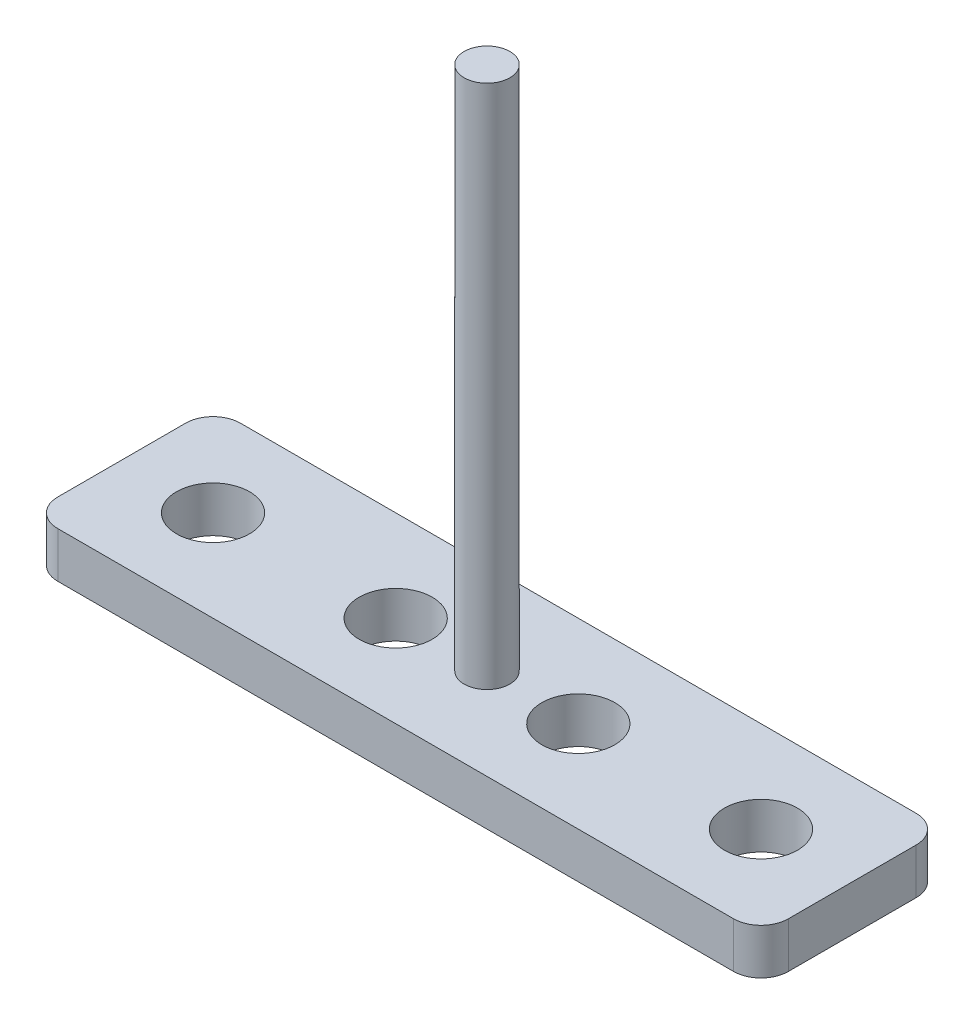
from build123d import *

# Parameters (mm, degrees)
SKETCH1_W             = 80
SKETCH1_H             = 20
BOSS_EXTRUDE1_DEPTH   = 2.5
F_8_0MM_DOWEL_HOLE1_D = 8
SKETCH6_R             = 2.5
BOSS_EXTRUDE2_DEPTH   = 60
FILLET1_R             = 3


with BuildPart() as part:
    # Sketch1 → Boss-Extrude1 (new, symmetric)
    with BuildSketch(Plane(origin=(0, 0, 0), x_dir=(1, 0, 0), z_dir=(0, 1, 0))):
        Rectangle(SKETCH1_W, SKETCH1_H)
    extrude(amount=BOSS_EXTRUDE1_DEPTH, both=True)

    # Ø8.0mm Dowel Hole1 (through all)
    with Locations(Plane(origin=(0, 2.5, 0), x_dir=(1, 0, 0), z_dir=(0, 1, 0))):
        with Locations((-30, 0), (-10, 0), (10, 0), (30, 0)):
            Hole(F_8_0MM_DOWEL_HOLE1_D / 2)

    # Sketch6 → Boss-Extrude2 (add)
    with BuildSketch(Plane(origin=(0, 0, 0), x_dir=(1, 0, 0), z_dir=(0, 1, 0))):
        with Locations(Location((0, 0, 0), (0, 0, 90))):
            Circle(SKETCH6_R)
    extrude(amount=BOSS_EXTRUDE2_DEPTH)

    # Fillet1
    fillet1_edges = [part.edges().sort_by_distance(p)[0] for p in [
        (40, 0, 10),
        (-40, 0, 10),
        (-40, 0, -10),
        (40, 0, -10),
    ]]
    fillet(fillet1_edges, radius=FILLET1_R)


solid = part.part
